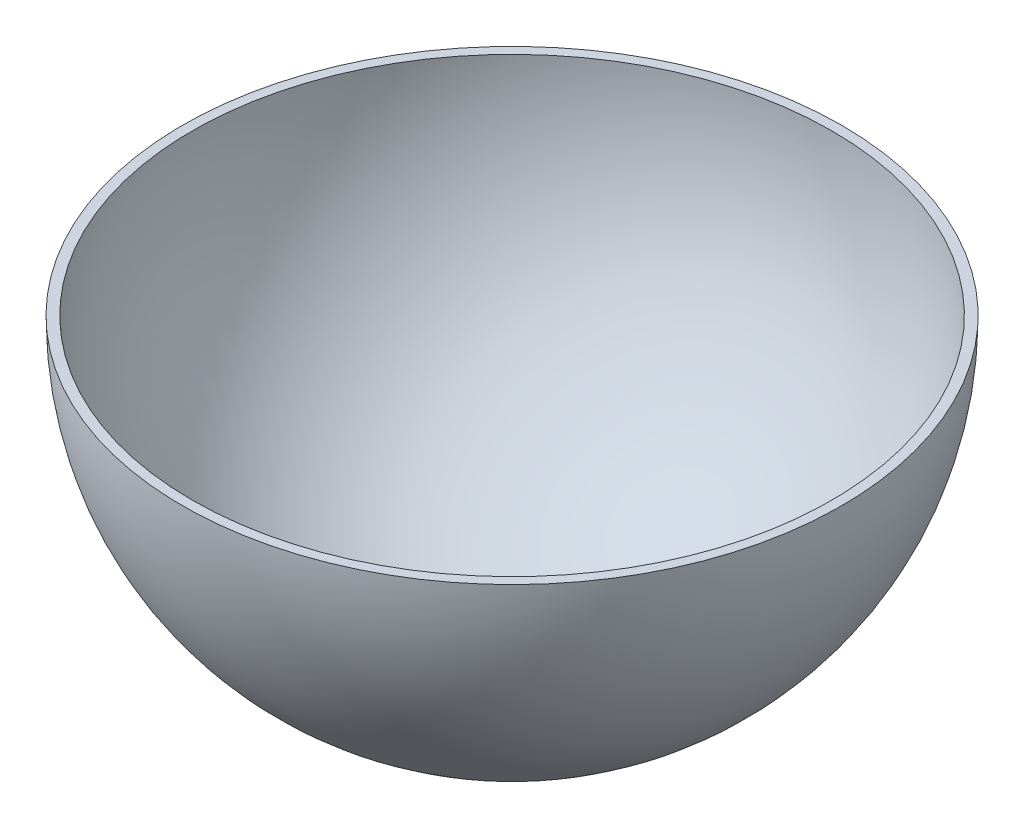
from build123d import *

# Parameters (mm, degrees)
REVOLVE5_ANGLE = 180


with BuildPart() as part:
    # Sketch1 → Revolve5 (revolve)
    with BuildSketch(Plane(origin=(0, 0, 0), x_dir=(1, 0, 0), z_dir=(0, 1, 0))):
        with BuildLine():
            Line((-101.6, 0), (-98.6, 0))
            ThreePointArc((-98.6, 0), (0, -98.6), (98.6, 0))
            Line((98.6, 0), (101.6, 0))
            ThreePointArc((101.6, 0), (0, -101.6), (-101.6, 0))
        make_face()
    revolve(axis=Axis((-90.153599067, 0, 0), (1, 0, 0)), revolution_arc=REVOLVE5_ANGLE)


solid = part.part
